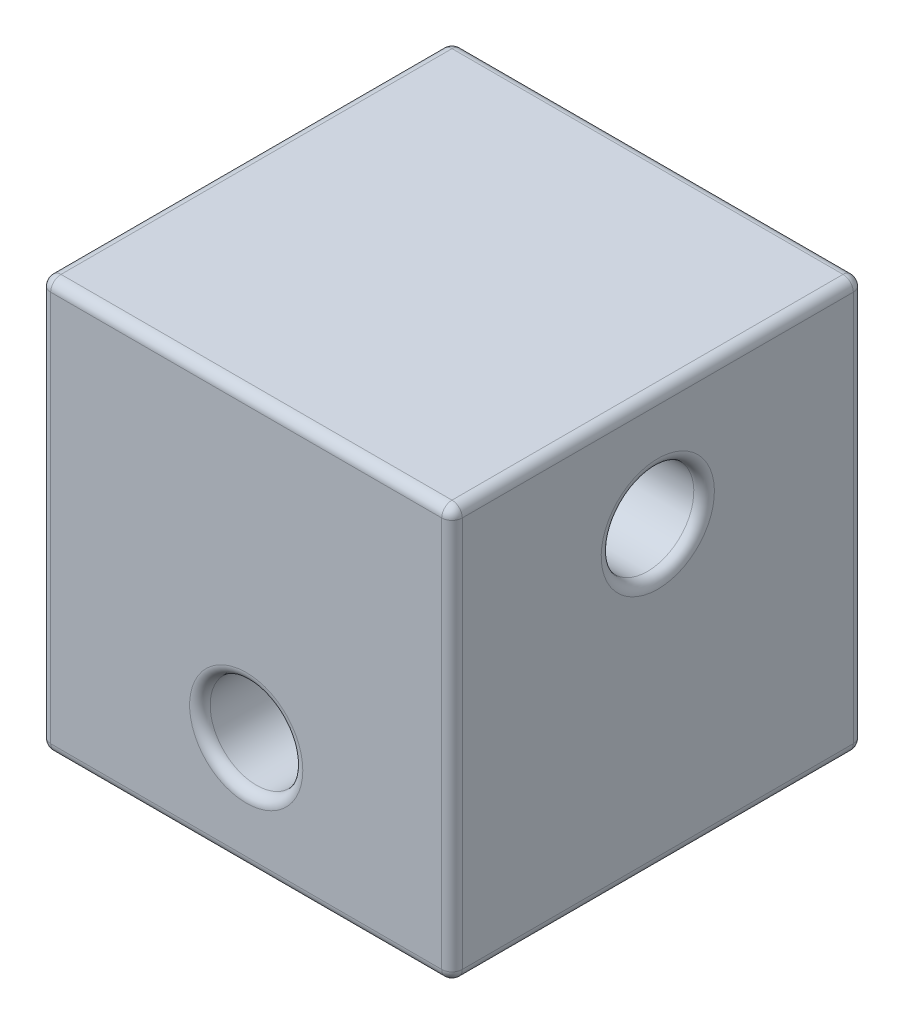
from build123d import *

# Parameters (mm, degrees)
SKETCH1_W           = 40
SKETCH1_H           = 40
BOSS_EXTRUDE1_DEPTH = 20
SKETCH2_R           = 4.5
CUT_EXTRUDE1_DEPTH  = 49.989794856
SKETCH3_R           = 4.5
CUT_EXTRUDE2_DEPTH  = 49.989794856
FILLET1_R           = 1


with BuildPart() as part:
    # Sketch1 → Boss-Extrude1 (new, symmetric)
    with BuildSketch(Plane.XY):
        Rectangle(SKETCH1_W, SKETCH1_H)
    extrude(amount=BOSS_EXTRUDE1_DEPTH, both=True)

    # Sketch2 → Cut-Extrude1 (cut, through all)
    with BuildSketch(Plane.XY.offset(20)):
        with Locations((0, -9)):
            Circle(SKETCH2_R)
    extrude(amount=-CUT_EXTRUDE1_DEPTH, mode=Mode.SUBTRACT)

    # Sketch3 → Cut-Extrude2 (cut, through all)
    with BuildSketch(Plane.ZY.offset(20)):
        with Locations(Location((0, 9, 0), (0, 0, 270))):
            Circle(SKETCH3_R)
    extrude(amount=-CUT_EXTRUDE2_DEPTH, mode=Mode.SUBTRACT)

    # Fillet1
    fillet1_edges = [part.edges().sort_by_distance(p)[0] for p in [
        (-20, 0, 20),
        (-4.5, -9, -20),
        (-4.5, -9, 20),
        (0, -20, 20),
        (20, 13.5, 0),
        (-20, 13.5, 0),
        (20, 0, 20),
        (0, -20, -20),
        (-20, 0, -20),
        (0, 20, -20),
        (20, 0, -20),
        (20, -20, 0),
        (-20, -20, 0),
        (-20, 20, 0),
        (20, 20, 0),
        (0, 20, 20),
    ]]
    fillet(fillet1_edges, radius=FILLET1_R)


solid = part.part
